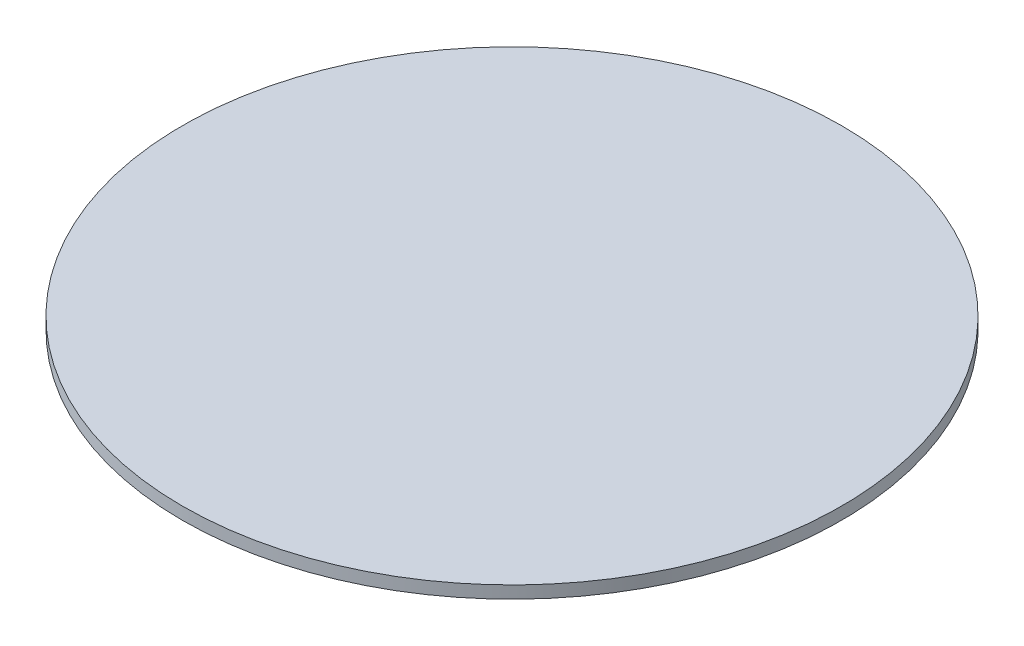
from build123d import *

# Parameters (mm, degrees)
SKETCH1_R                     = 160
TEPSI_DISK_D320_ALU_1_5_DEPTH = 6


with BuildPart() as part:
    # Sketch1 → TEPSI_disk_D320_alu_1.5 (new body)
    with BuildSketch(Plane(origin=(0, 0, 0), x_dir=(1, 0, 0), z_dir=(0, 1, 0))):
        with Locations(Location((0, 0, 0), (0, 0, 270))):
            Circle(SKETCH1_R)
    extrude(amount=TEPSI_DISK_D320_ALU_1_5_DEPTH)


solid = part.part
